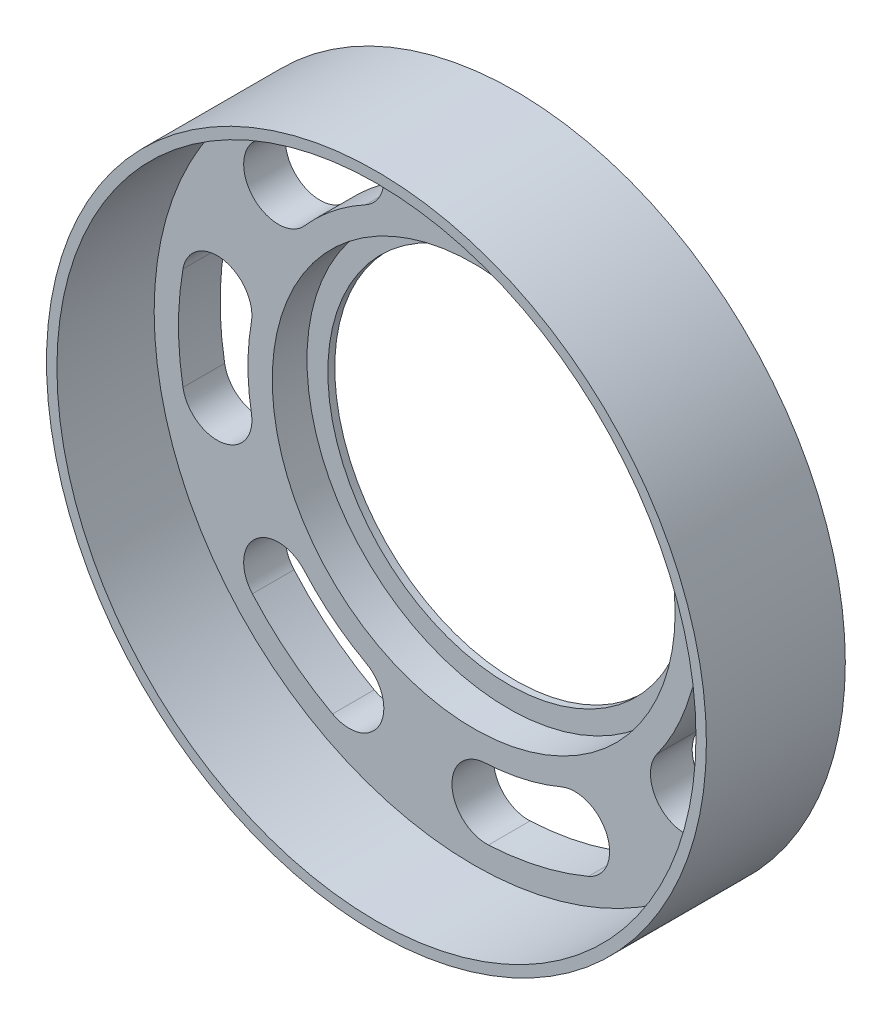
from build123d import *

# Parameters (mm, degrees)
SKETCH1_R           = 47.5
SKETCH1_R_2         = 46
BOSS_EXTRUDE1_DEPTH = 20
SKETCH1_5_R         = 46
SKETCH1_5_R_2       = 29
BOSS_EXTRUDE2_DEPTH = 6
SKETCH1_7_R         = 29
SKETCH1_7_R_2       = 26
BOSS_EXTRUDE4_DEPTH = 1


with BuildPart() as part:
    # Sketch1 → Boss-Extrude1 (new body)
    with BuildSketch(Plane.XY):
        Circle(SKETCH1_R)
        Circle(SKETCH1_R_2, mode=Mode.SUBTRACT)
    extrude(amount=BOSS_EXTRUDE1_DEPTH)

    # Sketch1<5> → Boss-Extrude2 (add)
    with BuildSketch(Plane.XY):
        Circle(SKETCH1_5_R)
        with BuildLine():
            ThreePointArc((-31.865701126, -28.121648098), (-31.425224299, -21.064312895), (-24.367889096, -21.504789722))
            ThreePointArc((-24.367889096, -21.504789722), (-20.26341856, -25.40952318), (-15.543254305, -28.542201135))
            ThreePointArc((-15.543254305, -28.542201135), (-13.543416331, -35.324578894), (-20.325794091, -37.324416868))
            ThreePointArc((-20.325794091, -37.324416868), (-26.498316579, -33.227838005), (-31.865701126, -28.121648098))
        make_face(mode=Mode.SUBTRACT)
        with BuildLine():
            ThreePointArc((2.118450141, -42.447169152), (-3.124563894, -37.702613974), (1.619991284, -32.45959994))
            ThreePointArc((1.619991284, -32.45959994), (7.231930354, -31.685157146), (12.624130879, -29.947976886))
            ThreePointArc((12.624130879, -29.947976886), (19.17368592, -32.613183964), (16.508478842, -39.162739004))
            ThreePointArc((16.508478842, -39.162739004), (9.457139693, -41.434436268), (2.118450141, -42.447169152))
        make_face(mode=Mode.SUBTRACT)
        with BuildLine():
            ThreePointArc((34.507365243, -24.80910607), (27.528956853, -25.950077737), (26.387985186, -18.971669348))
            ThreePointArc((26.387985186, -18.971669348), (29.281488207, -14.101221521), (31.285288026, -8.802315215))
            ThreePointArc((31.285288026, -8.802315215), (37.452611601, -5.343396321), (40.911530495, -11.510719896))
            ThreePointArc((40.911530495, -11.510719896), (38.291176886, -18.440058912), (34.507365243, -24.80910607))
        make_face(mode=Mode.SUBTRACT)
        with BuildLine():
            ThreePointArc((-41.854329503, -7.380047551), (-42.5, 0), (-41.854329503, 7.380047551))
            ThreePointArc((-41.854329503, 7.380047551), (-36.06204985, 11.435845428), (-32.006251973, 5.643565774))
            ThreePointArc((-32.006251973, 5.643565774), (-32.5, 0), (-32.006251973, -5.643565774))
            ThreePointArc((-32.006251973, -5.643565774), (-36.06204985, -11.435845428), (-41.854329503, -7.380047551))
        make_face(mode=Mode.SUBTRACT)
        with BuildLine():
            ThreePointArc((-20.325794091, 37.324416868), (-13.543416331, 35.324578894), (-15.543254305, 28.542201135))
            ThreePointArc((-15.543254305, 28.542201135), (-20.26341856, 25.40952318), (-24.367889096, 21.504789722))
            ThreePointArc((-24.367889096, 21.504789722), (-31.425224299, 21.064312895), (-31.865701126, 28.121648098))
            ThreePointArc((-31.865701126, 28.121648098), (-26.498316579, 33.227838005), (-20.325794091, 37.324416868))
        make_face(mode=Mode.SUBTRACT)
        Circle(SKETCH1_5_R_2, mode=Mode.SUBTRACT)
        with BuildLine():
            ThreePointArc((40.911530495, 11.510719896), (37.452611601, 5.343396321), (31.285288026, 8.802315215))
            ThreePointArc((31.285288026, 8.802315215), (29.281488207, 14.101221521), (26.387985186, 18.971669348))
            ThreePointArc((26.387985186, 18.971669348), (27.528956853, 25.950077737), (34.507365243, 24.80910607))
            ThreePointArc((34.507365243, 24.80910607), (38.291176886, 18.440058912), (40.911530495, 11.510719896))
        make_face(mode=Mode.SUBTRACT)
        with BuildLine():
            ThreePointArc((16.508478842, 39.162739004), (19.17368592, 32.613183964), (12.624130879, 29.947976886))
            ThreePointArc((12.624130879, 29.947976886), (7.231930354, 31.685157146), (1.619991284, 32.45959994))
            ThreePointArc((1.619991284, 32.45959994), (-3.124563894, 37.702613974), (2.118450141, 42.447169152))
            ThreePointArc((2.118450141, 42.447169152), (9.457139693, 41.434436268), (16.508478842, 39.162739004))
        make_face(mode=Mode.SUBTRACT)
    extrude(amount=BOSS_EXTRUDE2_DEPTH)

    # Sketch1<7> → Boss-Extrude4 (add)
    with BuildSketch(Plane.XY):
        Circle(SKETCH1_7_R)
        Circle(SKETCH1_7_R_2, mode=Mode.SUBTRACT)
    extrude(amount=BOSS_EXTRUDE4_DEPTH)


solid = part.part
